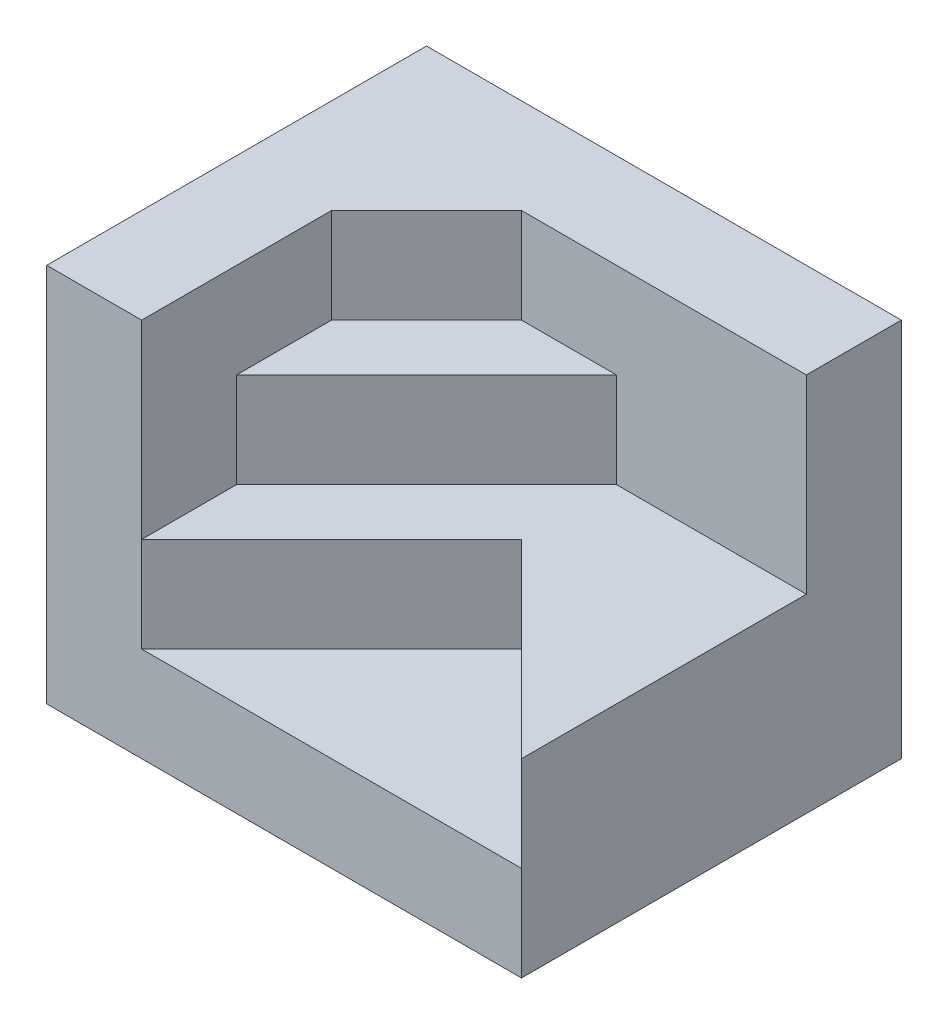
from build123d import *

# Parameters (mm, degrees)
SKETCH_1_W          = 25
SKETCH_1_H          = 20
EXTRUDE_1_DEPTH     = 20
CUT_EXTRUDE_1_DEPTH = 5
CUT_EXTRUDE_2_DEPTH = 10
CUT_EXTRUDE_3_DEPTH = 5


with BuildPart() as part:
    # 草圖1 → 填料-伸長1 (new body)
    with BuildSketch(Plane.XY):
        with Locations((12.5, -10)):
            Rectangle(SKETCH_1_W, SKETCH_1_H)
    extrude(amount=-EXTRUDE_1_DEPTH)

    # 草圖2 → 除料-伸長1 (cut)
    with BuildSketch(Plane(origin=(0, 0, 0), x_dir=(1, 0, 0), z_dir=(0, 1, 0))):
        Polygon((10, 15), (5, 10), (5, 5), (15, 15), align=None)
    extrude(amount=-CUT_EXTRUDE_1_DEPTH, mode=Mode.SUBTRACT)

    # 草圖3 → 除料-伸長2 (cut)
    with BuildSketch(Plane(origin=(0, 0, 0), x_dir=(1, 0, 0), z_dir=(0, 1, 0))):
        Polygon((15, 15), (5, 5), (5, 0), (25, 0), (25, 15), align=None)
    extrude(amount=-CUT_EXTRUDE_2_DEPTH, mode=Mode.SUBTRACT)

    # 草圖4 → 除料-伸長3 (cut)
    with BuildSketch(Plane(origin=(0, -10, 0), x_dir=(1, 0, 0), z_dir=(0, 1, 0))):
        Polygon((5, 0), (15, 10), (25, 0), align=None)
    extrude(amount=-CUT_EXTRUDE_3_DEPTH, mode=Mode.SUBTRACT)


solid = part.part
